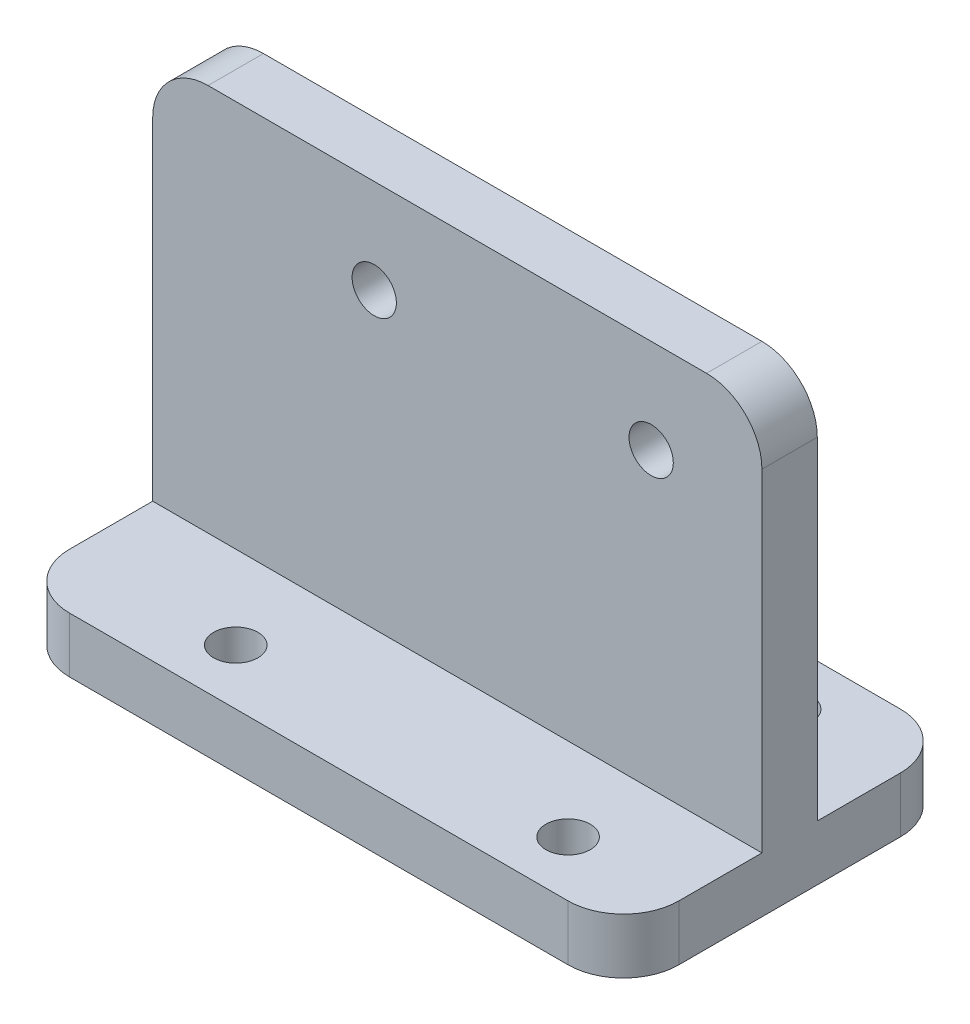
from build123d import *

# Parameters (mm, degrees)
SKETCH1_W           = 55
SKETCH1_H           = 35
SKETCH1_R           = 2
BOSS_EXTRUDE1_DEPTH = 5
SKETCH2_W           = 55
SKETCH2_H           = 30
BOSS_EXTRUDE2_DEPTH = 5
CUT_EXTRUDE1_DEPTH  = 5
FILLET1_R           = 5


with BuildPart() as part:
    # Sketch1 → Boss-Extrude1 (new body)
    with BuildSketch(Plane.XY):
        with Locations((27.5, 17.5)):
            Rectangle(SKETCH1_W, SKETCH1_H)
        with Locations((20, 26.5)):
            Circle(SKETCH1_R, mode=Mode.SUBTRACT)
        with Locations((45, 26.5)):
            Circle(SKETCH1_R, mode=Mode.SUBTRACT)
    extrude(amount=BOSS_EXTRUDE1_DEPTH)

    # Sketch2 → Boss-Extrude2 (add)
    with BuildSketch(Plane.XZ):
        with Locations((27.5, 2.5)):
            Rectangle(SKETCH2_W, SKETCH2_H)
    extrude(amount=BOSS_EXTRUDE2_DEPTH)

    # Sketch5 → Cut-Extrude1 (cut)
    with BuildSketch(Plane.XZ.offset(5)):
        with BuildLine():
            ThreePointArc((17, 12.5), (13.585786438, 13.914213562), (15, 10.5))
            Line((15, 10.5), (15, 12.5))
            Line((15, 12.5), (17, 12.5))
        make_face()
        with BuildLine():
            Line((15, 12.5), (15, 10.5))
            ThreePointArc((15, 10.5), (16.414213562, 11.085786438), (17, 12.5))
            Line((17, 12.5), (15, 12.5))
        make_face()
        with BuildLine():
            ThreePointArc((43, 12.5), (43.585786438, 11.085786438), (45, 10.5))
            Line((45, 10.5), (45, 12.5))
            Line((45, 12.5), (43, 12.5))
        make_face()
        with BuildLine():
            Line((45, 12.5), (45, 10.5))
            ThreePointArc((45, 10.5), (46.414213562, 11.085786438), (47, 12.5))
            ThreePointArc((47, 12.5), (45, 14.5), (43, 12.5))
            Line((43, 12.5), (45, 12.5))
        make_face()
        with BuildLine():
            ThreePointArc((45, -5.5), (43.585786438, -6.085786438), (43, -7.5))
            Line((43, -7.5), (45, -7.5))
            Line((45, -7.5), (45, -5.5))
        make_face()
        with BuildLine():
            Line((45, -7.5), (43, -7.5))
            ThreePointArc((43, -7.5), (45, -9.5), (47, -7.5))
            ThreePointArc((47, -7.5), (46.414213562, -6.085786438), (45, -5.5))
            Line((45, -5.5), (45, -7.5))
        make_face()
        with BuildLine():
            Line((15, -5.5), (15, -7.5))
            Line((15, -7.5), (17, -7.5))
            ThreePointArc((17, -7.5), (16.414213562, -6.085786438), (15, -5.5))
        make_face()
        with BuildLine():
            Line((17, -7.5), (15, -7.5))
            Line((15, -7.5), (15, -5.5))
            ThreePointArc((15, -5.5), (13.585786438, -8.914213562), (17, -7.5))
        make_face()
    extrude(amount=-CUT_EXTRUDE1_DEPTH, mode=Mode.SUBTRACT)

    # Fillet1
    fillet1_edges = [part.edges().sort_by_distance(p)[0] for p in [
        (0, -2.5, 17.5),
        (0, -2.5, -12.5),
        (55, -2.5, -12.5),
        (55, -2.5, 17.5),
        (0, 35, 2.5),
        (55, 35, 2.5),
    ]]
    fillet(fillet1_edges, radius=FILLET1_R)


solid = part.part
